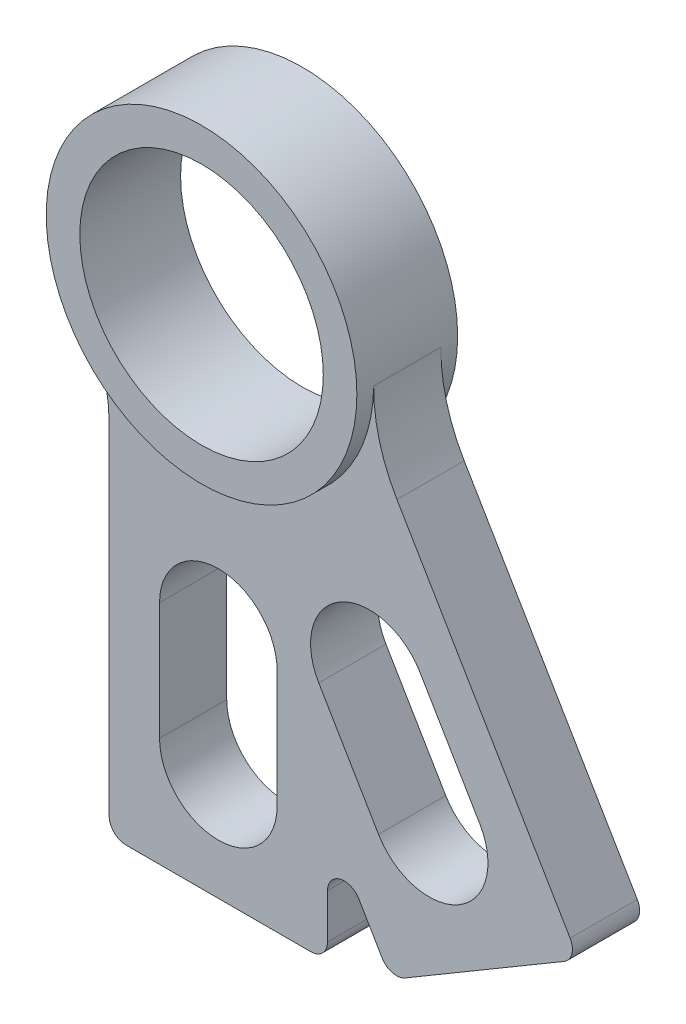
from build123d import *
from build123d.topology import SkipClean

# Parameters (mm, degrees)
SKETCH1_R           = 11.5062
BOSS_EXTRUDE1_DEPTH = 4.7625
CUT_EXTRUDE1_START  = 4.7625
CUT_EXTRUDE1_DEPTH  = 1.5875
CUT_EXTRUDE2_START  = -3.175
CUT_EXTRUDE2_DEPTH  = 1.5875
FILLET1_R           = 1.5875


with BuildPart() as part:
    # Sketch1 → Boss-Extrude1 (new, symmetric)
    # profile 1 of 2: a face of its own
    with BuildSketch(Plane.XY):
        with BuildLine():
            ThreePointArc((-12.585193267, -7.559797873), (-10.89585042, -11.492870345), (-10.31875, -15.734319794))
            Line((-10.31875, -15.734319794), (-10.31875, -49.389319794))
            Line((-10.31875, -49.389319794), (10.31875, -49.389319794))
            Line((10.31875, -49.389319794), (10.31875, -37.783763396))
            Line((10.31875, -37.783763396), (16.282292064, -47.887675791))
            Line((16.282292064, -47.887675791), (34.055016522, -37.397839205))
            Line((34.055016522, -37.397839205), (16.883960941, -8.3052564))
            ThreePointArc((16.883960941, -8.3052564), (15.225065006, -4.359245427), (14.68076155, -0.11346257))
            ThreePointArc((14.68076155, -0.11346257), (3.867793812, -14.162549363), (-12.585193267, -7.559797873))
        make_face()
        with BuildLine():
            ThreePointArc((5.55625, -39.070569794), (0, -44.626819794), (-5.55625, -39.070569794))
            Line((-5.55625, -39.070569794), (-5.55625, -27.958069794))
            ThreePointArc((-5.55625, -27.958069794), (0, -22.401819794), (5.55625, -27.958069794))
            Line((5.55625, -27.958069794), (5.55625, -39.070569794))
        make_face(mode=Mode.SUBTRACT)
        with BuildLine():
            ThreePointArc((24.708700277, -30.932208496), (22.747922773, -38.541359546), (15.138771723, -36.580582042))
            Line((15.138771723, -36.580582042), (9.490398177, -27.010653488))
            ThreePointArc((9.490398177, -27.010653488), (11.451175681, -19.401502438), (19.060326731, -21.362279942))
            Line((19.060326731, -21.362279942), (24.708700277, -30.932208496))
        make_face(mode=Mode.SUBTRACT)
    # profile 2 of 2: a face of its own
    with BuildSketch(Plane.XY):
        with BuildLine():
            ThreePointArc((14.68076155, -0.11346257), (-3.867793812, 14.162549363), (-12.585193267, -7.559797873))
            ThreePointArc((-12.585193267, -7.559797873), (3.867793812, -14.162549363), (14.68076155, -0.11346257))
        make_face()
        with Locations(Location((0, 0, 0), (0, 0, 180))):
            Circle(SKETCH1_R, mode=Mode.SUBTRACT)
    extrude(amount=BOSS_EXTRUDE1_DEPTH, both=True)

    # Sketch3 → Cut-Extrude1 (cut)
    with SkipClean():  # the faces are left unmerged after this step: merging them gives an invalid solid
        with BuildSketch(Plane.XY.offset(CUT_EXTRUDE1_START)):
            with BuildLine():
                ThreePointArc((-12.585193267, -7.559797873), (3.867793812, -14.162549363), (14.68076155, -0.11346257))
                ThreePointArc((14.68076155, -0.11346257), (15.225065006, -4.359245427), (16.883960941, -8.3052564))
                Line((16.883960941, -8.3052564), (34.055016522, -37.397839205))
                Line((34.055016522, -37.397839205), (16.282292064, -47.887675791))
                Line((16.282292064, -47.887675791), (10.31875, -37.783763396))
                Line((10.31875, -37.783763396), (10.31875, -49.389319794))
                Line((10.31875, -49.389319794), (-10.31875, -49.389319794))
                Line((-10.31875, -49.389319794), (-10.31875, -15.734319794))
                ThreePointArc((-10.31875, -15.734319794), (-10.89585042, -11.492870345), (-12.585193267, -7.559797873))
            make_face()
            with BuildLine():
                ThreePointArc((19.060326731, -21.362279942), (11.451175681, -19.401502438), (9.490398177, -27.010653488))
                Line((9.490398177, -27.010653488), (15.138771723, -36.580582042))
                ThreePointArc((15.138771723, -36.580582042), (22.747922773, -38.541359546), (24.708700277, -30.932208496))
                Line((24.708700277, -30.932208496), (19.060326731, -21.362279942))
            make_face(mode=Mode.SUBTRACT)
            with BuildLine():
                ThreePointArc((5.55625, -27.958069794), (0, -22.401819794), (-5.55625, -27.958069794))
                Line((-5.55625, -27.958069794), (-5.55625, -39.070569794))
                ThreePointArc((-5.55625, -39.070569794), (0, -44.626819794), (5.55625, -39.070569794))
                Line((5.55625, -39.070569794), (5.55625, -27.958069794))
            make_face(mode=Mode.SUBTRACT)
        extrude(amount=-CUT_EXTRUDE1_DEPTH, mode=Mode.SUBTRACT)

    # Sketch3<11> → Cut-Extrude2 (cut)
    with SkipClean():  # the faces are left unmerged after this step: merging them gives an invalid solid
        with BuildSketch(Plane.XY.offset(CUT_EXTRUDE2_START)):
            with BuildLine():
                ThreePointArc((-12.585193267, -7.559797873), (3.867793812, -14.162549363), (14.68076155, -0.11346257))
                ThreePointArc((14.68076155, -0.11346257), (15.225065006, -4.359245427), (16.883960941, -8.3052564))
                Line((16.883960941, -8.3052564), (34.055016522, -37.397839205))
                Line((34.055016522, -37.397839205), (16.282292064, -47.887675791))
                Line((16.282292064, -47.887675791), (10.31875, -37.783763396))
                Line((10.31875, -37.783763396), (10.31875, -49.389319794))
                Line((10.31875, -49.389319794), (-10.31875, -49.389319794))
                Line((-10.31875, -49.389319794), (-10.31875, -15.734319794))
                ThreePointArc((-10.31875, -15.734319794), (-10.89585042, -11.492870345), (-12.585193267, -7.559797873))
            make_face()
            with BuildLine():
                ThreePointArc((19.060326731, -21.362279942), (11.451175681, -19.401502438), (9.490398177, -27.010653488))
                Line((9.490398177, -27.010653488), (15.138771723, -36.580582042))
                ThreePointArc((15.138771723, -36.580582042), (22.747922773, -38.541359546), (24.708700277, -30.932208496))
                Line((24.708700277, -30.932208496), (19.060326731, -21.362279942))
            make_face(mode=Mode.SUBTRACT)
            with BuildLine():
                ThreePointArc((5.55625, -27.958069794), (0, -22.401819794), (-5.55625, -27.958069794))
                Line((-5.55625, -27.958069794), (-5.55625, -39.070569794))
                ThreePointArc((-5.55625, -39.070569794), (0, -44.626819794), (5.55625, -39.070569794))
                Line((5.55625, -39.070569794), (5.55625, -27.958069794))
            make_face(mode=Mode.SUBTRACT)
        extrude(amount=-CUT_EXTRUDE2_DEPTH, mode=Mode.SUBTRACT)

    # Fillet1
    fillet1_edges = [part.edges().sort_by_distance(p)[0] for p in [
        (34.055016522, -37.397839205, 0),
        (16.282292064, -47.887675791, 0),
        (10.31875, -37.783763396, 0),
        (10.31875, -49.389319794, 0),
        (-10.31875, -49.389319794, 0),
    ]]
    fillet(fillet1_edges, radius=FILLET1_R)


solid = part.part
